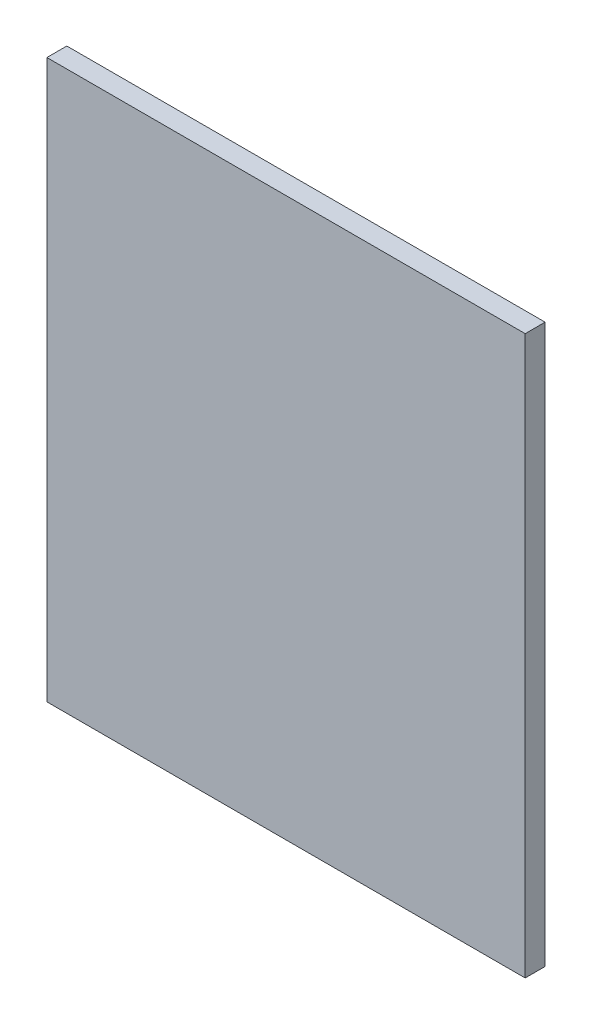
from build123d import *

# Parameters (mm, degrees)
SKETCH1_W           = 152.4
SKETCH1_H           = 177.8
BOSS_EXTRUDE1_DEPTH = 6.35


with BuildPart() as part:
    # Sketch1 → Boss-Extrude1 (new body)
    with BuildSketch(Plane.XY):
        Rectangle(SKETCH1_W, SKETCH1_H)
    extrude(amount=BOSS_EXTRUDE1_DEPTH)


solid = part.part
